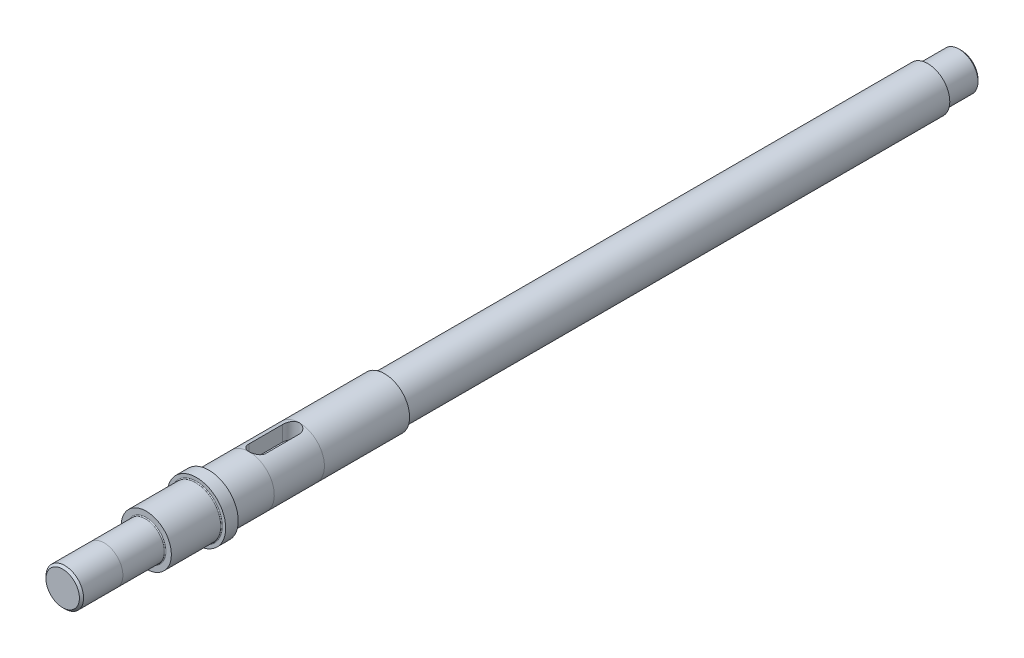
from build123d import *

# Parameters (mm, degrees)
SKETCH_1_R          = 5.25
EXTRUDE_1_DEPTH     = 130
SKETCH_2_R          = 6
EXTRUDE_2_DEPTH     = 42
SKETCH_3_R          = 7
EXTRUDE_3_DEPTH     = 3
SKETCH_4_R          = 6
EXTRUDE_4_DEPTH     = 12
SKETCH_5_R          = 4.5
EXTRUDE_5_DEPTH     = 8
EXTRUDE_START       = 8
SKETCH_6_R          = 4.5
EXTRUDE_6_DEPTH     = 8
CUT_EXTRUDE_1_DEPTH = 10
FILLET_2_R          = 0.2
FILLET_4_R          = 0.2
FILLET_5_R          = 0.2
SKETCH_19_R         = 4.5
EXTRUDE_7_DEPTH     = 12
FILLET_6_R          = 0.2
FILLET_7_R          = 0.2
CHAMFER_1_SIZE      = 0.5


with BuildPart() as part:
    # Эскиз1 → Бобышка-Вытянуть1 (new body)
    with BuildSketch(Plane.XY):
        Circle(SKETCH_1_R)
    extrude(amount=EXTRUDE_1_DEPTH)

    # Эскиз2 → Бобышка-Вытянуть2 (add)
    with BuildSketch(Plane.XY.offset(130)):
        with Locations(Location((0, 0, 0), (0, 0, 180))):
            Circle(SKETCH_2_R)
    extrude(amount=EXTRUDE_2_DEPTH)

    # Эскиз3 → Бобышка-Вытянуть3 (add)
    with BuildSketch(Plane.XY.offset(172)):
        Circle(SKETCH_3_R)
    extrude(amount=EXTRUDE_3_DEPTH)

    # Эскиз4 → Бобышка-Вытянуть4 (add)
    with BuildSketch(Plane.XY.offset(175)):
        with Locations(Location((0, 0, 0), (0, 0, 180))):
            Circle(SKETCH_4_R)
    extrude(amount=EXTRUDE_4_DEPTH)

    # Эскиз5 → Бобышка-Вытянуть5 (add)
    with BuildSketch(Plane.XY.offset(187)):
        Circle(SKETCH_5_R)
    extrude(amount=EXTRUDE_5_DEPTH)

    # Эскиз6 → Бобышка-Вытянуть6 (add)
    with BuildSketch(Plane(origin=(0, 0, 0), x_dir=(-1, 0, 0), z_dir=(0, 0, -1)).offset(EXTRUDE_START)):
        with Locations(Location((0, 0, 0), (0, 0, 180))):
            Circle(SKETCH_6_R)
    extrude(amount=-EXTRUDE_6_DEPTH)

    # Эскиз18 → Вырез-Вытянуть1 (cut)
    with BuildSketch(Plane(origin=(0, 12, 0), x_dir=(1, 0, 0), z_dir=(0, 1, 0))):
        with BuildLine():
            Line((-2, -160.373495066), (-2, -152.373495066))
            ThreePointArc((-2, -152.373495066), (0, -150.373495066), (2, -152.373495066))
            Line((2, -152.373495066), (2, -160.373495066))
            ThreePointArc((2, -160.373495066), (0, -162.373495066), (-2, -160.373495066))
        make_face()
    extrude(amount=-CUT_EXTRUDE_1_DEPTH, mode=Mode.SUBTRACT)

    # Скругление2
    fillet_2_edges = [part.edges().sort_by_distance(p)[0] for p in [
        (-4.5, 0, 0),
    ]]
    fillet(fillet_2_edges, radius=FILLET_2_R)

    # Скругление4
    fillet_4_edges = [part.edges().sort_by_distance(p)[0] for p in [
        (6, 0, 175),
    ]]
    fillet(fillet_4_edges, radius=FILLET_4_R)

    # Скругление5
    fillet_5_edges = [part.edges().sort_by_distance(p)[0] for p in [
        (-4.5, 0, 187),
    ]]
    fillet(fillet_5_edges, radius=FILLET_5_R)

    # Эскиз19 → Бобышка-Вытянуть7 (add)
    with BuildSketch(Plane.XY.offset(195)):
        Circle(SKETCH_19_R)
    extrude(amount=EXTRUDE_7_DEPTH)

    # Скругление6
    fillet_6_edges = [part.edges().sort_by_distance(p)[0] for p in [
        (-5.25, 0, 130),
    ]]
    fillet(fillet_6_edges, radius=FILLET_6_R)

    # Скругление7
    fillet_7_edges = [part.edges().sort_by_distance(p)[0] for p in [
        (6, 0, 172),
    ]]
    fillet(fillet_7_edges, radius=FILLET_7_R)

    # Фаска1
    chamfer_1_edges = [part.edges().sort_by_distance(p)[0] for p in [
        (-4.5, 0, -8),
        (-4.5, 0, 207),
    ]]
    chamfer(chamfer_1_edges, length=CHAMFER_1_SIZE)


solid = part.part
